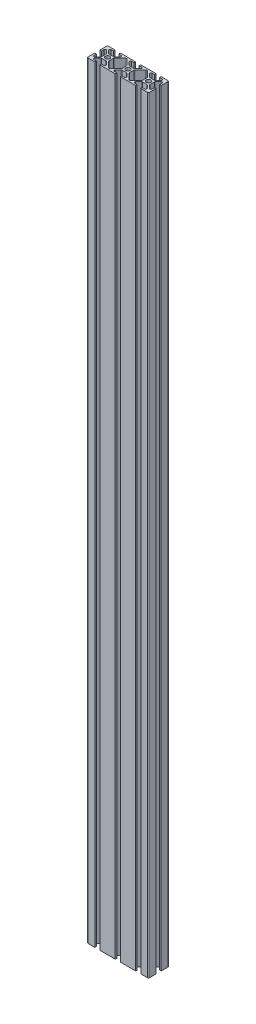
from build123d import *

# Parameters (mm, degrees)
SKETCH1_R           = 2.15
BOSS_EXTRUDE1_DEPTH = 750


with BuildPart() as part:
    # Sketch1 → Boss-Extrude1 (new body)
    with BuildSketch(Plane(origin=(0, 0, 0), x_dir=(1, 0, 0), z_dir=(0, 1, 0))):
        with BuildLine():
            Line((7.5, 20), (7.5, 18.5))
            Line((7.5, 18.5), (5.014213562, 18.5))
            ThreePointArc((5.014213562, 18.5), (4.09033403, 17.882683432), (4.307106781, 16.792893219))
            Line((4.307106781, 16.792893219), (7.207106781, 13.892893219))
            ThreePointArc((7.207106781, 13.892893219), (7.53153013, 13.676120467), (7.914213562, 13.6))
            Line((7.914213562, 13.6), (12.085786438, 13.6))
            ThreePointArc((12.085786438, 13.6), (12.46846987, 13.676120467), (12.792893219, 13.892893219))
            Line((12.792893219, 13.892893219), (15.692893219, 16.792893219))
            ThreePointArc((15.692893219, 16.792893219), (15.90966597, 17.882683432), (14.985786438, 18.5))
            Line((14.985786438, 18.5), (12.5, 18.5))
            Line((12.5, 18.5), (12.5, 20))
            Line((12.5, 20), (27.5, 20))
            Line((27.5, 20), (27.5, 18.5))
            Line((27.5, 18.5), (25.014213562, 18.5))
            ThreePointArc((25.014213562, 18.5), (24.09033403, 17.882683432), (24.307106781, 16.792893219))
            Line((24.307106781, 16.792893219), (27.207106781, 13.892893219))
            ThreePointArc((27.207106781, 13.892893219), (27.53153013, 13.676120467), (27.914213562, 13.6))
            Line((27.914213562, 13.6), (32.085786438, 13.6))
            ThreePointArc((32.085786438, 13.6), (32.46846987, 13.676120467), (32.792893219, 13.892893219))
            Line((32.792893219, 13.892893219), (35.692893219, 16.792893219))
            ThreePointArc((35.692893219, 16.792893219), (35.90966597, 17.882683432), (34.985786438, 18.5))
            Line((34.985786438, 18.5), (32.5, 18.5))
            Line((32.5, 18.5), (32.5, 20))
            Line((32.5, 20), (47.5, 20))
            Line((47.5, 20), (47.5, 18.5))
            Line((47.5, 18.5), (45.014213562, 18.5))
            ThreePointArc((45.014213562, 18.5), (44.09033403, 17.882683432), (44.307106781, 16.792893219))
            Line((44.307106781, 16.792893219), (47.207106781, 13.892893219))
            ThreePointArc((47.207106781, 13.892893219), (47.53153013, 13.676120467), (47.914213562, 13.6))
            Line((47.914213562, 13.6), (52.085786438, 13.6))
            ThreePointArc((52.085786438, 13.6), (52.46846987, 13.676120467), (52.792893219, 13.892893219))
            Line((52.792893219, 13.892893219), (55.692893219, 16.792893219))
            ThreePointArc((55.692893219, 16.792893219), (55.90966597, 17.882683432), (54.985786438, 18.5))
            Line((54.985786438, 18.5), (52.5, 18.5))
            Line((52.5, 18.5), (52.5, 20))
            Line((52.5, 20), (59, 20))
            ThreePointArc((59, 20), (59.707106781, 19.707106781), (60, 19))
            Line((60, 19), (60, 12.5))
            Line((60, 12.5), (58.5, 12.5))
            Line((58.5, 12.5), (58.5, 14.985786438))
            ThreePointArc((58.5, 14.985786438), (57.882683432, 15.90966597), (56.792893219, 15.692893219))
            Line((56.792893219, 15.692893219), (53.892893219, 12.792893219))
            ThreePointArc((53.892893219, 12.792893219), (53.676120467, 12.46846987), (53.6, 12.085786438))
            Line((53.6, 12.085786438), (53.6, 7.914213562))
            ThreePointArc((53.6, 7.914213562), (53.676120467, 7.53153013), (53.892893219, 7.207106781))
            Line((53.892893219, 7.207106781), (56.792893219, 4.307106781))
            ThreePointArc((56.792893219, 4.307106781), (57.882683432, 4.09033403), (58.5, 5.014213562))
            Line((58.5, 5.014213562), (58.5, 7.5))
            Line((58.5, 7.5), (60, 7.5))
            Line((60, 7.5), (60, 1))
            ThreePointArc((60, 1), (59.707106781, 0.292893219), (59, 0))
            Line((59, 0), (52.5, 0))
            Line((52.5, 0), (52.5, 1.5))
            Line((52.5, 1.5), (54.985786438, 1.5))
            ThreePointArc((54.985786438, 1.5), (55.90966597, 2.117316568), (55.692893219, 3.207106781))
            Line((55.692893219, 3.207106781), (52.792893219, 6.107106781))
            ThreePointArc((52.792893219, 6.107106781), (52.46846987, 6.323879533), (52.085786438, 6.4))
            Line((52.085786438, 6.4), (47.914213562, 6.4))
            ThreePointArc((47.914213562, 6.4), (47.53153013, 6.323879533), (47.207106781, 6.107106781))
            Line((47.207106781, 6.107106781), (44.307106781, 3.207106781))
            ThreePointArc((44.307106781, 3.207106781), (44.09033403, 2.117316568), (45.014213562, 1.5))
            Line((45.014213562, 1.5), (47.5, 1.5))
            Line((47.5, 1.5), (47.5, 0))
            Line((47.5, 0), (32.5, 0))
            Line((32.5, 0), (32.5, 1.5))
            Line((32.5, 1.5), (34.985786438, 1.5))
            ThreePointArc((34.985786438, 1.5), (35.90966597, 2.117316568), (35.692893219, 3.207106781))
            Line((35.692893219, 3.207106781), (32.792893219, 6.107106781))
            ThreePointArc((32.792893219, 6.107106781), (32.46846987, 6.323879533), (32.085786438, 6.4))
            Line((32.085786438, 6.4), (27.914213562, 6.4))
            ThreePointArc((27.914213562, 6.4), (27.53153013, 6.323879533), (27.207106781, 6.107106781))
            Line((27.207106781, 6.107106781), (24.307106781, 3.207106781))
            ThreePointArc((24.307106781, 3.207106781), (24.09033403, 2.117316568), (25.014213562, 1.5))
            Line((25.014213562, 1.5), (27.5, 1.5))
            Line((27.5, 1.5), (27.5, 0))
            Line((27.5, 0), (12.5, 0))
            Line((12.5, 0), (12.5, 1.5))
            Line((12.5, 1.5), (14.985786438, 1.5))
            ThreePointArc((14.985786438, 1.5), (15.90966597, 2.117316568), (15.692893219, 3.207106781))
            Line((15.692893219, 3.207106781), (12.792893219, 6.107106781))
            ThreePointArc((12.792893219, 6.107106781), (12.46846987, 6.323879533), (12.085786438, 6.4))
            Line((12.085786438, 6.4), (7.914213562, 6.4))
            ThreePointArc((7.914213562, 6.4), (7.53153013, 6.323879533), (7.207106781, 6.107106781))
            Line((7.207106781, 6.107106781), (4.307106781, 3.207106781))
            ThreePointArc((4.307106781, 3.207106781), (4.09033403, 2.117316568), (5.014213562, 1.5))
            Line((5.014213562, 1.5), (7.5, 1.5))
            Line((7.5, 1.5), (7.5, 0))
            Line((7.5, 0), (1, 0))
            ThreePointArc((1, 0), (0.292893219, 0.292893219), (0, 1))
            Line((0, 1), (0, 7.5))
            Line((0, 7.5), (1.5, 7.5))
            Line((1.5, 7.5), (1.5, 5.014213562))
            ThreePointArc((1.5, 5.014213562), (2.117316568, 4.09033403), (3.207106781, 4.307106781))
            Line((3.207106781, 4.307106781), (6.107106781, 7.207106781))
            ThreePointArc((6.107106781, 7.207106781), (6.323879533, 7.53153013), (6.4, 7.914213562))
            Line((6.4, 7.914213562), (6.4, 12.085786438))
            ThreePointArc((6.4, 12.085786438), (6.323879533, 12.46846987), (6.107106781, 12.792893219))
            Line((6.107106781, 12.792893219), (3.207106781, 15.692893219))
            ThreePointArc((3.207106781, 15.692893219), (2.117316568, 15.90966597), (1.5, 14.985786438))
            Line((1.5, 14.985786438), (1.5, 12.5))
            Line((1.5, 12.5), (0, 12.5))
            Line((0, 12.5), (0, 19))
            ThreePointArc((0, 19), (0.292893219, 19.707106781), (1, 20))
            Line((1, 20), (7.5, 20))
        make_face()
        with Locations(Location((10, 10, 0), (0, 0, 270))):
            Circle(SKETCH1_R, mode=Mode.SUBTRACT)
        with Locations(Location((30, 10, 0), (0, 0, 270))):
            Circle(SKETCH1_R, mode=Mode.SUBTRACT)
        with Locations(Location((50, 10, 0), (0, 0, 270))):
            Circle(SKETCH1_R, mode=Mode.SUBTRACT)
        with BuildLine():
            Line((19.292893219, 18.192893219), (13.892893219, 12.792893219))
            ThreePointArc((13.892893219, 12.792893219), (13.676120467, 12.46846987), (13.6, 12.085786438))
            Line((13.6, 12.085786438), (13.6, 7.914213562))
            ThreePointArc((13.6, 7.914213562), (13.676120467, 7.53153013), (13.892893219, 7.207106781))
            Line((13.892893219, 7.207106781), (19.292893219, 1.807106781))
            ThreePointArc((19.292893219, 1.807106781), (20, 1.514213562), (20.707106781, 1.807106781))
            Line((20.707106781, 1.807106781), (26.107106781, 7.207106781))
            ThreePointArc((26.107106781, 7.207106781), (26.323879533, 7.53153013), (26.4, 7.914213562))
            Line((26.4, 7.914213562), (26.4, 12.085786438))
            ThreePointArc((26.4, 12.085786438), (26.323879533, 12.46846987), (26.107106781, 12.792893219))
            Line((26.107106781, 12.792893219), (20.707106781, 18.192893219))
            ThreePointArc((20.707106781, 18.192893219), (20, 18.485786438), (19.292893219, 18.192893219))
        make_face(mode=Mode.SUBTRACT)
        with BuildLine():
            Line((33.6, 12.085786438), (33.6, 7.914213562))
            ThreePointArc((33.6, 7.914213562), (33.676120467, 7.53153013), (33.892893219, 7.207106781))
            Line((33.892893219, 7.207106781), (39.292893219, 1.807106781))
            ThreePointArc((39.292893219, 1.807106781), (40, 1.514213562), (40.707106781, 1.807106781))
            Line((40.707106781, 1.807106781), (46.107106781, 7.207106781))
            ThreePointArc((46.107106781, 7.207106781), (46.323879533, 7.53153013), (46.4, 7.914213562))
            Line((46.4, 7.914213562), (46.4, 12.085786438))
            ThreePointArc((46.4, 12.085786438), (46.323879533, 12.46846987), (46.107106781, 12.792893219))
            Line((46.107106781, 12.792893219), (40.707106781, 18.192893219))
            ThreePointArc((40.707106781, 18.192893219), (40, 18.485786438), (39.292893219, 18.192893219))
            Line((39.292893219, 18.192893219), (33.892893219, 12.792893219))
            ThreePointArc((33.892893219, 12.792893219), (33.676120467, 12.46846987), (33.6, 12.085786438))
        make_face(mode=Mode.SUBTRACT)
    extrude(amount=BOSS_EXTRUDE1_DEPTH)


solid = part.part
